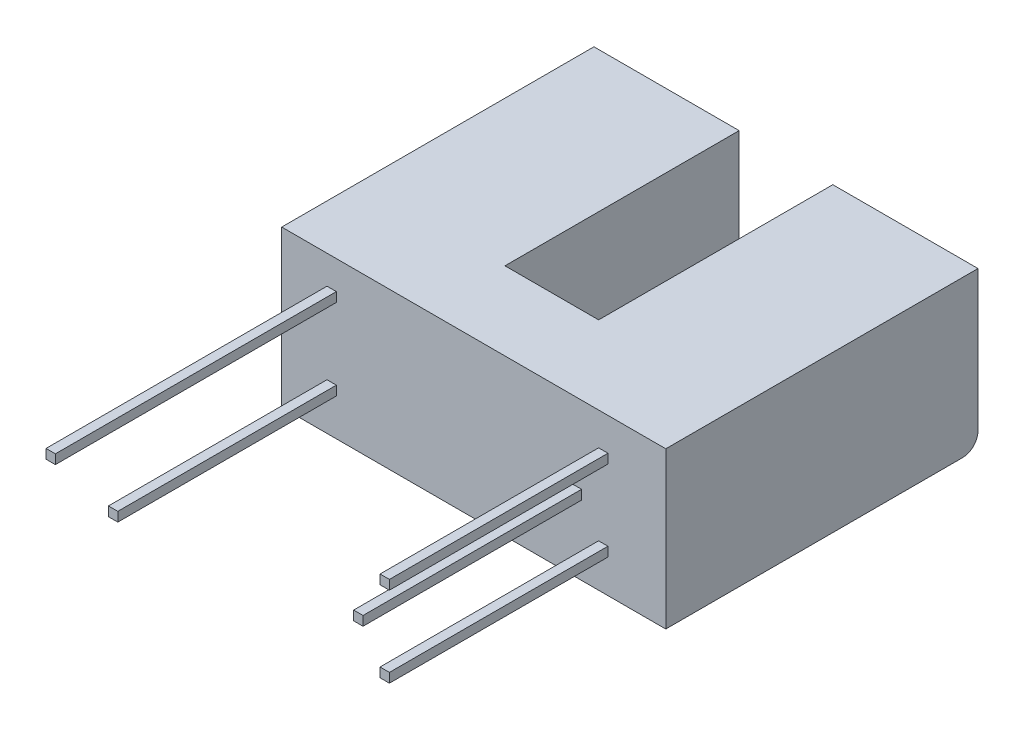
from build123d import *

# Parameters (mm, degrees)
SKETCH1_W           = 12.3
SKETCH1_H           = 10
BOSS_EXTRUDE1_DEPTH = 5
SKETCH2_W           = 1.5
SKETCH2_H           = 7.5
CUT_EXTRUDE1_DEPTH  = 5
LPATTERN1_COUNT     = 2
LPATTERN1_PITCH     = 1.5
FILLET4_R           = 0.5
SKETCH3_W           = 0.3
SKETCH3_H           = 0.3
BOSS_EXTRUDE2_DEPTH = 9
SKETCH4_W           = 0.3
SKETCH4_H           = 0.3
BOSS_EXTRUDE3_DEPTH = 7
SKETCH5_W           = 0.3
SKETCH5_H           = 0.3
BOSS_EXTRUDE4_DEPTH = 7
SKETCH6_W           = 0.3
SKETCH6_H           = 0.3
BOSS_EXTRUDE5_DEPTH = 7
SKETCH7_W           = 0.3
SKETCH7_H           = 0.3
BOSS_EXTRUDE6_DEPTH = 7


with BuildPart() as part:
    # Sketch1 → Boss-Extrude1 (new body)
    with BuildSketch(Plane(origin=(0, 0, 0), x_dir=(1, 0, 0), z_dir=(0, 1, 0))):
        Rectangle(SKETCH1_W, SKETCH1_H)
    extrude(amount=BOSS_EXTRUDE1_DEPTH)

    # Sketch2 → Cut-Extrude1 (cut)
    with BuildSketch(Plane(origin=(0, 5, 0), x_dir=(1, 0, 0), z_dir=(0, 1, 0))):
        with Locations((-0.75, 1.25)):
            Rectangle(SKETCH2_W, SKETCH2_H)
    cut_extrude1 = extrude(amount=-CUT_EXTRUDE1_DEPTH, mode=Mode.SUBTRACT)

    # LPattern1: Cut-Extrude1 ×2
    with Locations(*[(i * LPATTERN1_PITCH, 0, 0) for i in range(1, LPATTERN1_COUNT)]):
        add(cut_extrude1, mode=Mode.SUBTRACT)

    # Fillet4
    fillet4_edges = [part.edges().sort_by_distance(p)[0] for p in [
        (-3.825, 0, -5),
        (3.825, 0, -5),
    ]]
    fillet(fillet4_edges, radius=FILLET4_R)

    # Sketch3 → Boss-Extrude2 (add)
    with BuildSketch(Plane.XY.offset(5)):
        with Locations((-4.549701493, 3.935074627)):
            Rectangle(SKETCH3_W, SKETCH3_H)
    extrude(amount=BOSS_EXTRUDE2_DEPTH)

    # Sketch4 → Boss-Extrude3 (add)
    with BuildSketch(Plane.XY.offset(5)):
        with Locations((-4.549701493, 1.340298507)):
            Rectangle(SKETCH4_W, SKETCH4_H)
    extrude(amount=BOSS_EXTRUDE3_DEPTH)

    # Sketch5 → Boss-Extrude4 (add)
    with BuildSketch(Plane.XY.offset(5)):
        with Locations((4.149040482, 3.801410011)):
            Rectangle(SKETCH5_W, SKETCH5_H)
    extrude(amount=BOSS_EXTRUDE4_DEPTH)

    # Sketch6 → Boss-Extrude5 (add)
    with BuildSketch(Plane.XY.offset(5)):
        with Locations((4.149040482, 1.222139303)):
            Rectangle(SKETCH6_W, SKETCH6_H)
    extrude(amount=BOSS_EXTRUDE5_DEPTH)

    # Sketch7 → Boss-Extrude6 (add)
    with BuildSketch(Plane.XY.offset(5)):
        with Locations((3.303641109, 2.378478397)):
            Rectangle(SKETCH7_W, SKETCH7_H)
    extrude(amount=BOSS_EXTRUDE6_DEPTH)


solid = part.part
